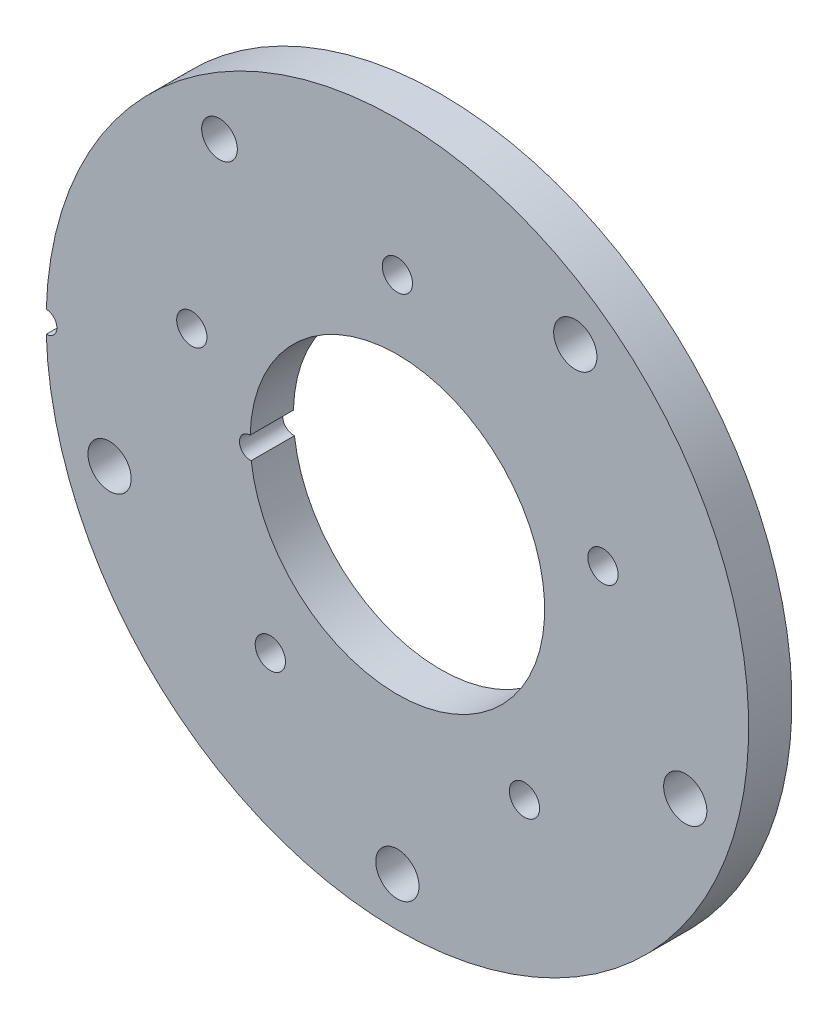
from build123d import *

# Parameters (mm, degrees)
SKETCH_1_R          = 32.5
SKETCH_1_R_2        = 13.625
SKETCH_1_R_3        = 2
SKETCH_1_R_4        = 1.65
SKETCH_1_R_5        = 1.4
EXTRUDE_1_DEPTH     = 4
SKETCH_2_R          = 1
CUT_EXTRUDE_1_DEPTH = 10


with BuildPart() as part:
    # 草图1 → 凸台-拉伸1 (new body)
    with BuildSketch(Plane.XY):
        with Locations((-0.261189045, 0.652972612)):
            Circle(SKETCH_1_R)
        with Locations((-0.261189045, 0.652972612)):
            Circle(SKETCH_1_R_2, mode=Mode.SUBTRACT)
        with Locations((-0.261189045, -27.347027388)):
            Circle(SKETCH_1_R_3, mode=Mode.SUBTRACT)
        with Locations((-26.890771501, -7.999503231)):
            Circle(SKETCH_1_R_3, mode=Mode.SUBTRACT)
        with Locations((-16.719176109, 23.305448454)):
            Circle(SKETCH_1_R_4, mode=Mode.SUBTRACT)
        with Locations((16.196798019, 23.305448454)):
            Circle(SKETCH_1_R_3, mode=Mode.SUBTRACT)
        with Locations((26.368393412, -7.999503231)):
            Circle(SKETCH_1_R_3, mode=Mode.SUBTRACT)
        with Locations((-12.016894091, -15.527367276)):
            Circle(SKETCH_1_R_5, mode=Mode.SUBTRACT)
        with Locations((-19.282319371, 6.833312499)):
            Circle(SKETCH_1_R_5, mode=Mode.SUBTRACT)
        with Locations((-0.261189045, 20.652972612)):
            Circle(SKETCH_1_R_5, mode=Mode.SUBTRACT)
        with Locations((18.759941281, 6.833312499)):
            Circle(SKETCH_1_R_5, mode=Mode.SUBTRACT)
        with Locations((11.494516001, -15.527367276)):
            Circle(SKETCH_1_R_5, mode=Mode.SUBTRACT)
    extrude(amount=EXTRUDE_1_DEPTH)

    # 草图2 → 切除-拉伸1 (cut)
    with BuildSketch(Plane.XY.offset(4)):
        with Locations((-13.870533326, 0)):
            Circle(SKETCH_2_R)
        with Locations((-32.761189045, 0.652972612)):
            Circle(SKETCH_2_R)
    extrude(amount=-CUT_EXTRUDE_1_DEPTH, mode=Mode.SUBTRACT)


solid = part.part
